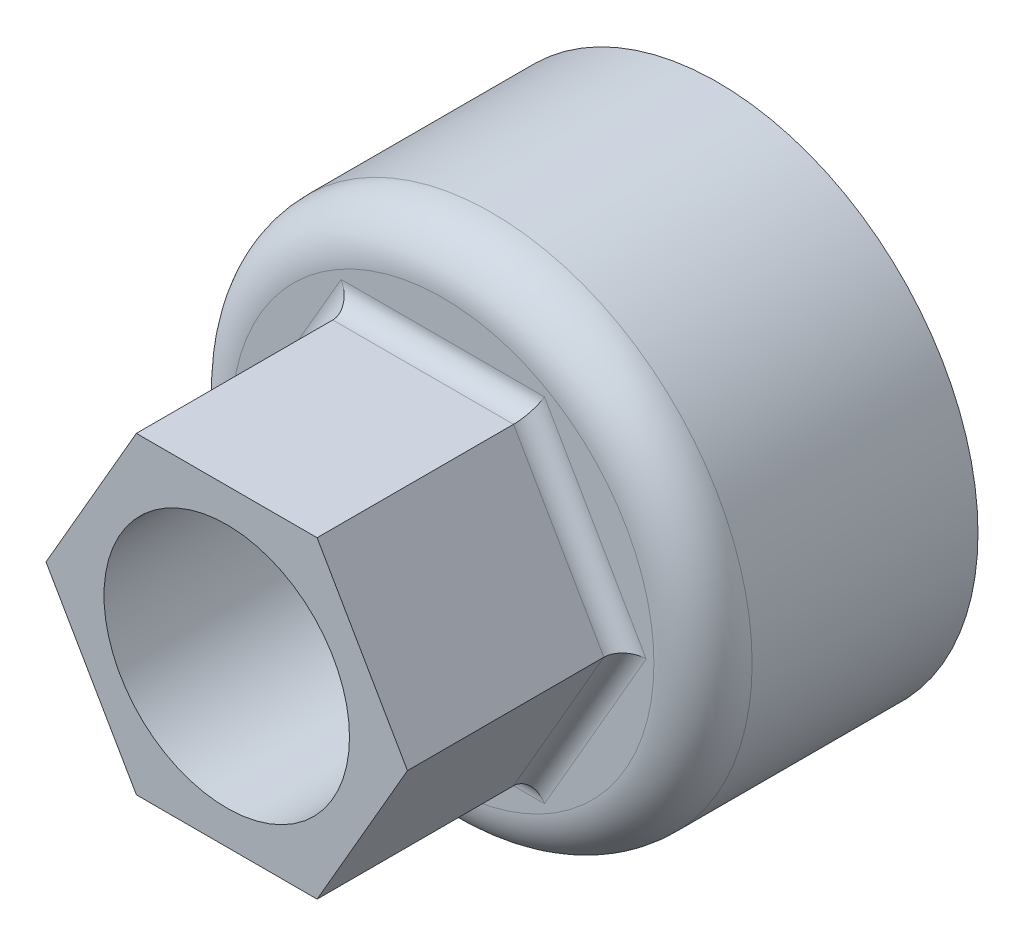
from build123d import *

# Parameters (mm, degrees)
SKETCH1_R           = 26.5
BOSS_EXTRUDE1_DEPTH = 25
SKETCH2_R           = 26.5
BOSS_EXTRUDE2_DEPTH = 25
CUT_EXTRUDE1_START  = -22
SKETCH3_R           = 26.5
CUT_EXTRUDE1_DEPTH  = 22
FILLET1_R           = 2
FILLET2_R           = 5
FILLET3_R           = 5
SKETCH4_R           = 12.5
CUT_EXTRUDE2_DEPTH  = 63.485998432


with BuildPart() as part:
    # Sketch1 → Boss-Extrude1 (new body)
    with BuildSketch(Plane.XY):
        Circle(SKETCH1_R)
        Polygon((10.421172359, 18.05), (-10.421172359, 18.05), (-20.842344718, 0), (-10.421172359, -18.05), (10.421172359, -18.05), (20.842344718, 0), align=None, mode=Mode.SUBTRACT)
    extrude(amount=BOSS_EXTRUDE1_DEPTH)

    # Sketch2 → Boss-Extrude2 (add)
    with BuildSketch(Plane.XY.offset(25)):
        Circle(SKETCH2_R)
    extrude(amount=BOSS_EXTRUDE2_DEPTH)

    # Sketch3 → Cut-Extrude1 (cut)
    with BuildSketch(Plane.XY.offset(50).offset(CUT_EXTRUDE1_START)):
        Circle(SKETCH3_R)
        Polygon((9.20178694, 15.937962501), (-9.20178694, 15.937962501), (-18.40357388, 0), (-9.20178694, -15.937962501), (9.20178694, -15.937962501), (18.40357388, 0), align=None, mode=Mode.SUBTRACT)
    extrude(amount=CUT_EXTRUDE1_DEPTH, mode=Mode.SUBTRACT)

    # Fillet1
    fillet1_edges = [part.edges().sort_by_distance(p)[0] for p in [
        (13.80268041, -7.96898125, 28),
        (13.80268041, 7.96898125, 28),
        (0, 15.937962501, 28),
        (-13.80268041, 7.96898125, 28),
        (-13.80268041, -7.96898125, 28),
        (0, -15.937962501, 28),
    ]]
    fillet(fillet1_edges, radius=FILLET1_R)

    # Fillet2
    fillet2_edges = [part.edges().sort_by_distance(p)[0] for p in [
        (15.631758538, 9.025, 25),
        (0, 18.05, 25),
        (-15.631758538, 9.025, 25),
        (-15.631758538, -9.025, 25),
        (0, -18.05, 25),
        (15.631758538, -9.025, 25),
    ]]
    fillet(fillet2_edges, radius=FILLET2_R)

    # Fillet3
    fillet3_edges = [part.edges().sort_by_distance(p)[0] for p in [
        (-26.5, 0, 28),
    ]]
    fillet(fillet3_edges, radius=FILLET3_R)

    # Sketch4 → Cut-Extrude2 (cut, through all)
    with BuildSketch(Plane.XY.offset(50)):
        Circle(SKETCH4_R)
    extrude(amount=-CUT_EXTRUDE2_DEPTH, mode=Mode.SUBTRACT)


solid = part.part
